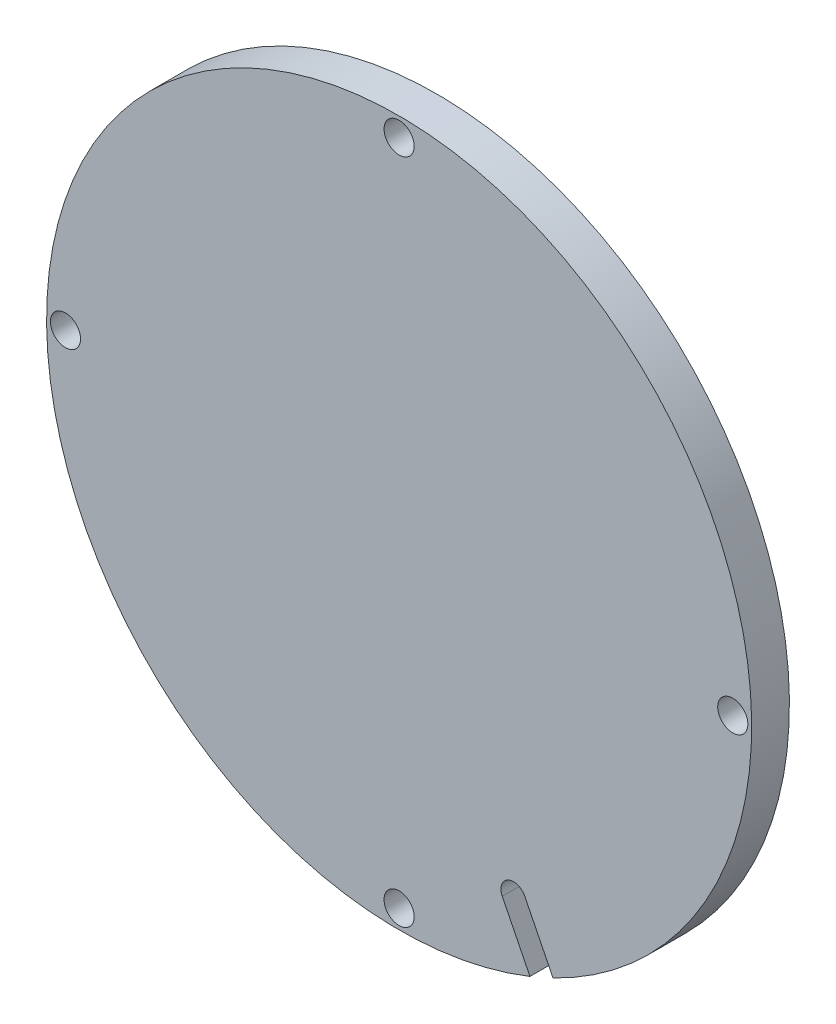
from build123d import *

# Parameters (mm, degrees)
SKETCH2_R               = 44.45
BOSS_EXTRUDE1_DEPTH     = 4.7625
F_6_CLEARANCE_HOLE1_D   = 3.7973
CIRPATTERN1_COUNT       = 4
CUT_EXTRUDE1_DEPTH      = 64.041941644
CUT_EXTRUDE1_DEPTH_BACK = 64.041941644


with BuildPart() as part:
    # Sketch2 → Boss-Extrude1 (new body)
    with BuildSketch(Plane.XY):
        with Locations(Location((0, 0, 0), (0, 0, 180))):
            Circle(SKETCH2_R)
    extrude(amount=BOSS_EXTRUDE1_DEPTH)

    # #6 Clearance Hole1 (through all)
    with Locations(Plane.XY.offset(4.7625)):
        with Locations((0, 42.06875)):
            f_6_clearance_hole1 = Hole(F_6_CLEARANCE_HOLE1_D / 2)

    # CirPattern1: #6 Clearance Hole1 ×4 about axis
    cirpattern1_axis = Axis((0, 0, 0), (0, 0, 1))
    for i in range(1, CIRPATTERN1_COUNT):
        add(f_6_clearance_hole1.rotate(cirpattern1_axis, i * 360 / CIRPATTERN1_COUNT), mode=Mode.SUBTRACT)

    # Sketch5 → Cut-Extrude1 (cut, two sides: drawn at the far end of the back side and taken through both)
    with BuildSketch(Plane.XY.offset(4.7625).offset(-CUT_EXTRUDE1_DEPTH_BACK)):
        with BuildLine():
            Line((16.539365803, -41.367349975), (13.001856878, -34.261722849))
            ThreePointArc((13.001856878, -34.261722849), (13.715480519, -32.133095639), (15.844107729, -32.846719279))
            Line((15.844107729, -32.846719279), (19.381616653, -39.952346405))
            ThreePointArc((19.381616653, -39.952346405), (18.667993013, -42.080973615), (16.539365803, -41.367349975))
        make_face()
    extrude(amount=CUT_EXTRUDE1_DEPTH + CUT_EXTRUDE1_DEPTH_BACK, mode=Mode.SUBTRACT)


solid = part.part
